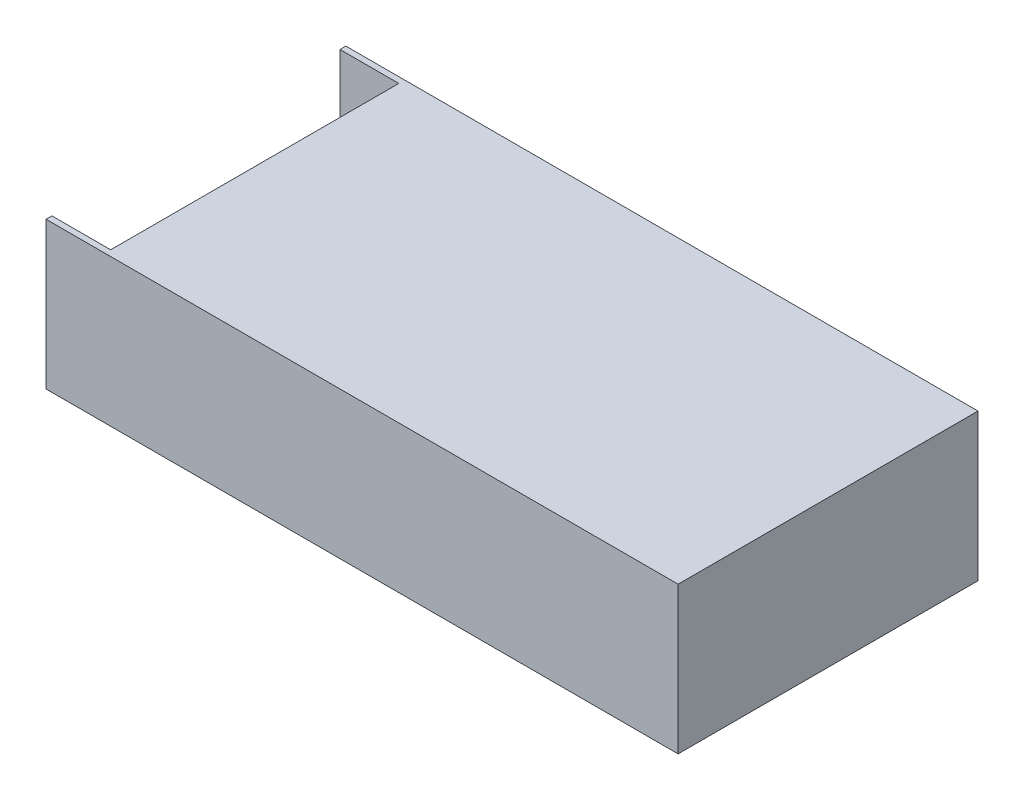
from build123d import *

# Parameters (mm, degrees)
SKETCH1_W           = 215
SKETCH1_H           = 102
BOSS_EXTRUDE1_DEPTH = 50
SKETCH2_W           = 20
SKETCH2_H           = 98
CUT_EXTRUDE1_DEPTH  = 25


with BuildPart() as part:
    # Sketch1 → Boss-Extrude1 (new body)
    with BuildSketch(Plane(origin=(0, 0, 0), x_dir=(1, 0, 0), z_dir=(0, 1, 0))):
        with Locations((107.5, 51)):
            Rectangle(SKETCH1_W, SKETCH1_H)
    extrude(amount=BOSS_EXTRUDE1_DEPTH)

    # Sketch2 → Cut-Extrude1 (cut)
    with BuildSketch(Plane(origin=(0, 50, 0), x_dir=(1, 0, 0), z_dir=(0, 1, 0))):
        with Locations((10, 51)):
            Rectangle(SKETCH2_W, SKETCH2_H)
    extrude(amount=-CUT_EXTRUDE1_DEPTH, mode=Mode.SUBTRACT)


solid = part.part
